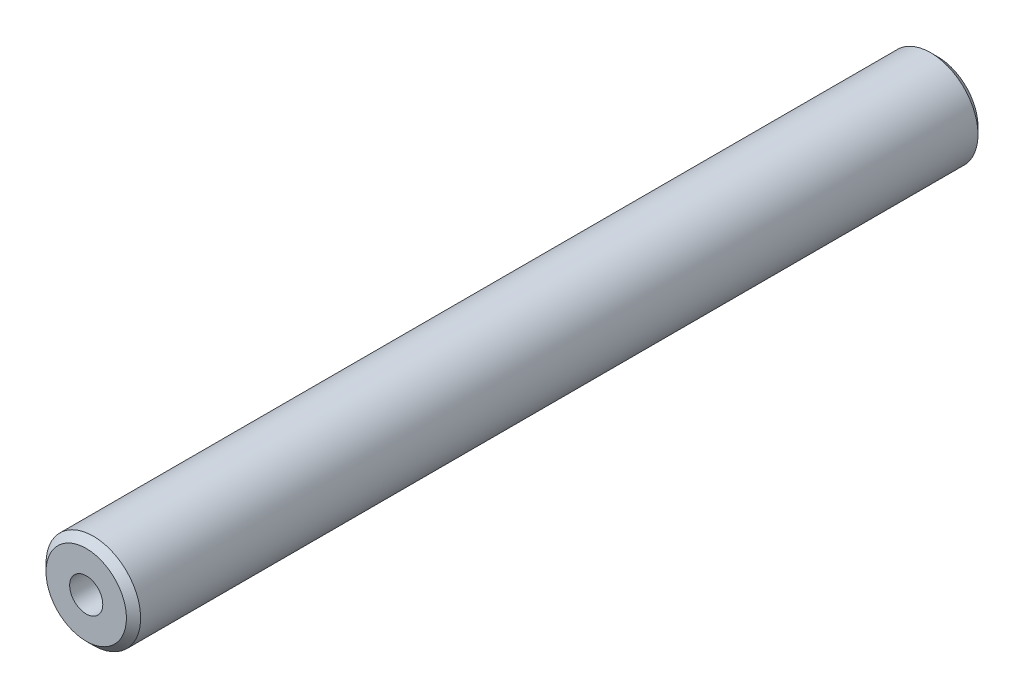
from build123d import *

# Parameters (mm, degrees)
SKETCH_1_R      = 10
EXTRUDE_1_DEPTH = 180
CHAMFER_1_SIZE  = 1.5
M8X1_0_1_D      = 7


with BuildPart() as part:
    # 草图1 → 凸台-拉伸1 (new body)
    with BuildSketch(Plane.XY):
        with Locations(Location((0, 0, 0), (0, 0, 180))):
            Circle(SKETCH_1_R)
    extrude(amount=EXTRUDE_1_DEPTH)

    # 倒角1
    chamfer_1_edges = [part.edges().sort_by_distance(p)[0] for p in [
        (10, 0, 0),
        (10, 0, 180),
    ]]
    chamfer(chamfer_1_edges, length=CHAMFER_1_SIZE)

    # M8x1.0 螺纹孔1 (through all)
    with Locations(Plane.XY.offset(180)):
        with Locations((0, 0)):
            Hole(M8X1_0_1_D / 2)


solid = part.part
